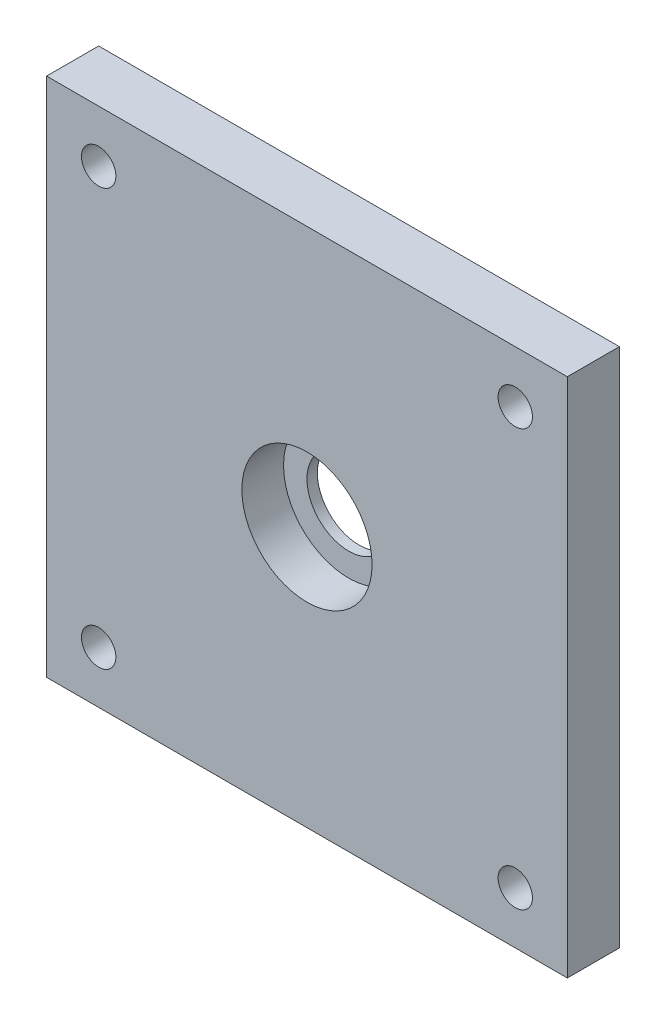
from build123d import *

# Parameters (mm, degrees)
SKETCH_1_W      = 50
SKETCH_1_H      = 50
SKETCH_1_R      = 1.65
SKETCH_1_R_2    = 6.25
EXTRUDE_1_DEPTH = 5
SKETCH_2_R      = 6.25
SKETCH_2_R_2    = 4
EXTRUDE_2_DEPTH = 1


with BuildPart() as part:
    # 草图1 → 凸台-拉伸1 (new body)
    with BuildSketch(Plane.XY):
        Rectangle(SKETCH_1_W, SKETCH_1_H)
        with Locations((-20, -20)):
            Circle(SKETCH_1_R, mode=Mode.SUBTRACT)
        with Locations((-20, 20)):
            Circle(SKETCH_1_R, mode=Mode.SUBTRACT)
        with Locations((20, 20)):
            Circle(SKETCH_1_R, mode=Mode.SUBTRACT)
        with Locations((20, -20)):
            Circle(SKETCH_1_R, mode=Mode.SUBTRACT)
        Circle(SKETCH_1_R_2, mode=Mode.SUBTRACT)
    extrude(amount=EXTRUDE_1_DEPTH)

    # 草图2 → 凸台-拉伸2 (add)
    with BuildSketch(Plane(origin=(0, 0, 0), x_dir=(-1, 0, 0), z_dir=(0, 0, -1))):
        Circle(SKETCH_2_R)
        Circle(SKETCH_2_R_2, mode=Mode.SUBTRACT)
    extrude(amount=-EXTRUDE_2_DEPTH)


solid = part.part
